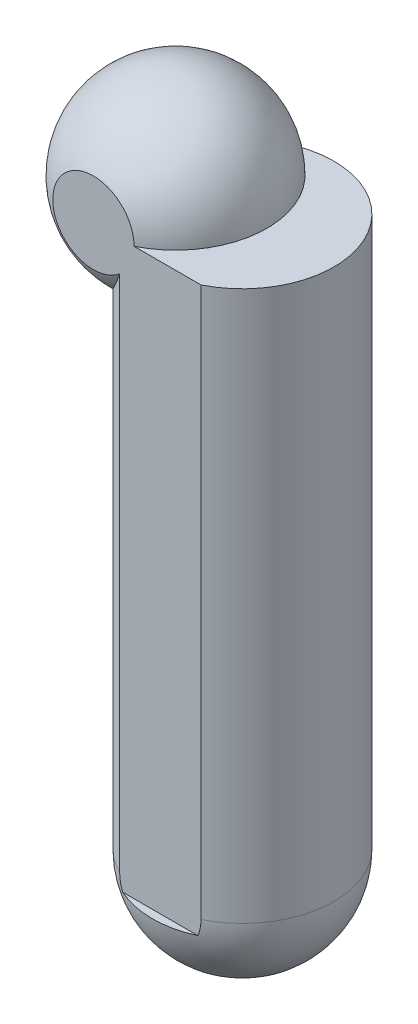
from build123d import *

# Parameters (mm, degrees)
SKETCH1_R               = 50
BOSS_EXTRUDE1_DEPTH     = 300
CUT_EXTRUDE1_DEPTH      = 364.987490242
CUT_EXTRUDE1_DEPTH_BACK = 364.987490242
SKETCH4_W               = 12.597132099
SKETCH4_H               = 279.427293847
CUT_EXTRUDE2_DEPTH      = 364.987490242
CUT_EXTRUDE2_DEPTH_BACK = 364.987490242
SKETCH5_W               = 13.949781053
SKETCH5_H               = 363.760783887


with BuildPart() as part:
    # Sketch1 → Boss-Extrude1 (new body)
    with BuildSketch(Plane(origin=(0, 0, 0), x_dir=(1, 0, 0), z_dir=(0, 1, 0))):
        with Locations(Location((0, 0, 0), (0, 0, 270))):
            Circle(SKETCH1_R)
    extrude(amount=BOSS_EXTRUDE1_DEPTH)

    # Sketch2 → Revolve1 (revolve)
    with BuildSketch(Plane.XY):
        with BuildLine():
            Line((-36.526834234, 250), (-36.526834234, 350))
            ThreePointArc((-36.526834234, 350), (13.473165766, 300), (-36.526834234, 250))
        make_face()
    revolve(axis=Axis((-36.526834234, 250, 0), (0, 1, 0)))

    # Sketch3 → Revolve2 (revolve)
    with BuildSketch(Plane.XY):
        with BuildLine():
            Line((0, -50), (0, 50))
            ThreePointArc((0, 50), (50, 0), (0, -50))
        make_face()
    revolve(axis=Axis((0, -50, 0), (0, 1, 0)))

    # Sketch4 → Cut-Extrude1 (cut, two sides: drawn at the far end of the back side and taken through both)
    with BuildSketch(Plane.XY.offset(-CUT_EXTRUDE1_DEPTH_BACK)):
        with Locations((-53.478127305, 108.200425306)):
            Rectangle(SKETCH4_W, SKETCH4_H)
    extrude(amount=CUT_EXTRUDE1_DEPTH + CUT_EXTRUDE1_DEPTH_BACK, mode=Mode.SUBTRACT)

    # Sketch5 → Cut-Extrude2 (cut, two sides: drawn at the far end of the back side and taken through both)
    with BuildSketch(Plane(origin=(0, 0, 0), x_dir=(0, 0, -1), z_dir=(1, 0, 0)).offset(-CUT_EXTRUDE2_DEPTH_BACK)):
        with Locations((-51.783725954, 173.445822779)):
            Rectangle(SKETCH5_W, SKETCH5_H)
    extrude(amount=CUT_EXTRUDE2_DEPTH + CUT_EXTRUDE2_DEPTH_BACK, mode=Mode.SUBTRACT)


solid = part.part
